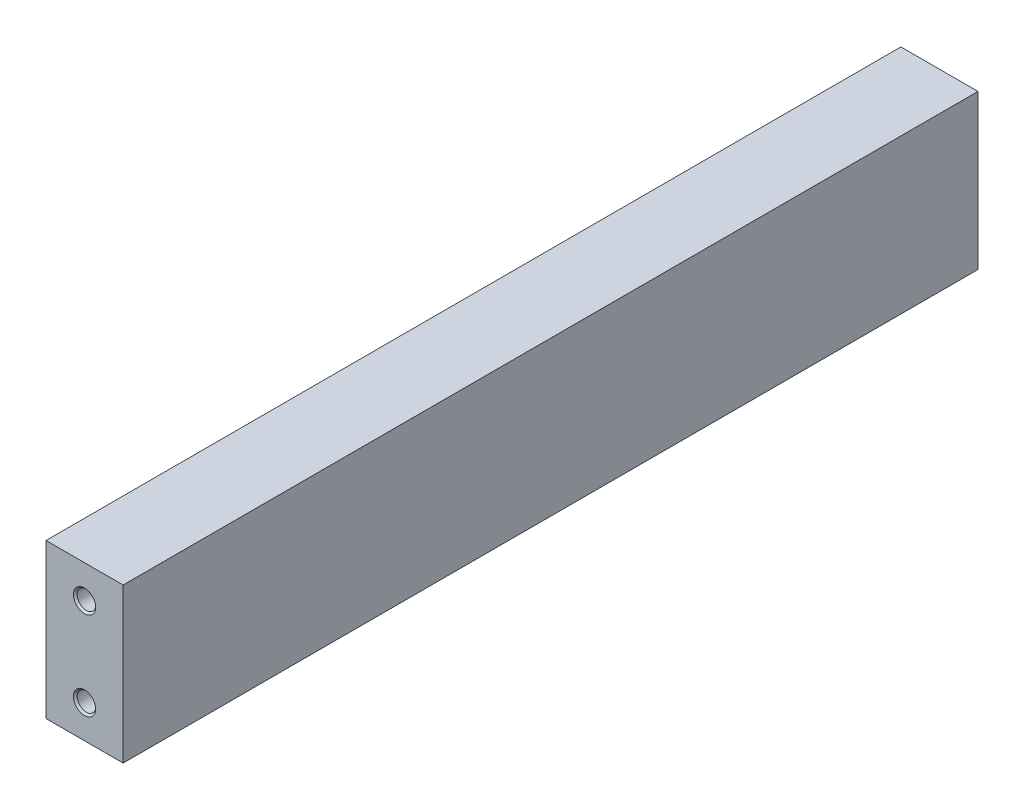
from build123d import *

# Parameters (mm, degrees)
SKETCH1_W                  = 17.5
SKETCH1_H                  = 35
BOSS_EXTRUDE1_DEPTH        = 97
M5_TAPPED_HOLE1_AT_2_COUNT = 2
M5_TAPPED_HOLE1_AT_2_PITCH = 20


with BuildPart() as part:
    # Sketch1 → Boss-Extrude1 (new, symmetric)
    with BuildSketch(Plane.XY):
        Rectangle(SKETCH1_W, SKETCH1_H)
    extrude(amount=BOSS_EXTRUDE1_DEPTH, both=True)

    # Sketch5 → M5 Tapped Hole1 (revolve, cut)
    with BuildSketch(Plane(origin=(0, 10, -97), x_dir=(0, 1, 0), z_dir=(1, 0, 0))):
        Polygon((0, 0), (0, 15.2618073), (2.1, 14), (2.1, 0.425), (2.525, 0), align=None)
    m5_tapped_hole1 = revolve(axis=Axis((0, 10, -103.35), (0, 0, 1)), mode=Mode.SUBTRACT)

    # M5 Tapped Hole1 at 2: M5 Tapped Hole1 ×2
    with Locations(*[(0, -i * M5_TAPPED_HOLE1_AT_2_PITCH, 0) for i in range(1, M5_TAPPED_HOLE1_AT_2_COUNT)]):
        add(m5_tapped_hole1, mode=Mode.SUBTRACT)

    # Mirror1: M5 Tapped Hole1 across plane
    add(m5_tapped_hole1.mirror(Plane.XY), mode=Mode.SUBTRACT)

    # Mirror1 copy 1 sketch → Mirror1 copy 1 (revolve, cut)
    with BuildSketch(Plane(origin=(0, -10, 97), x_dir=(0, 1, 0), z_dir=(1, 0, 0))):
        Polygon((0, 0), (0, -15.2618073), (2.1, -14), (2.1, -0.425), (2.525, 0), align=None)
    revolve(axis=Axis((0, -10, 103.35), (0, 0, 1)), mode=Mode.SUBTRACT)


solid = part.part
